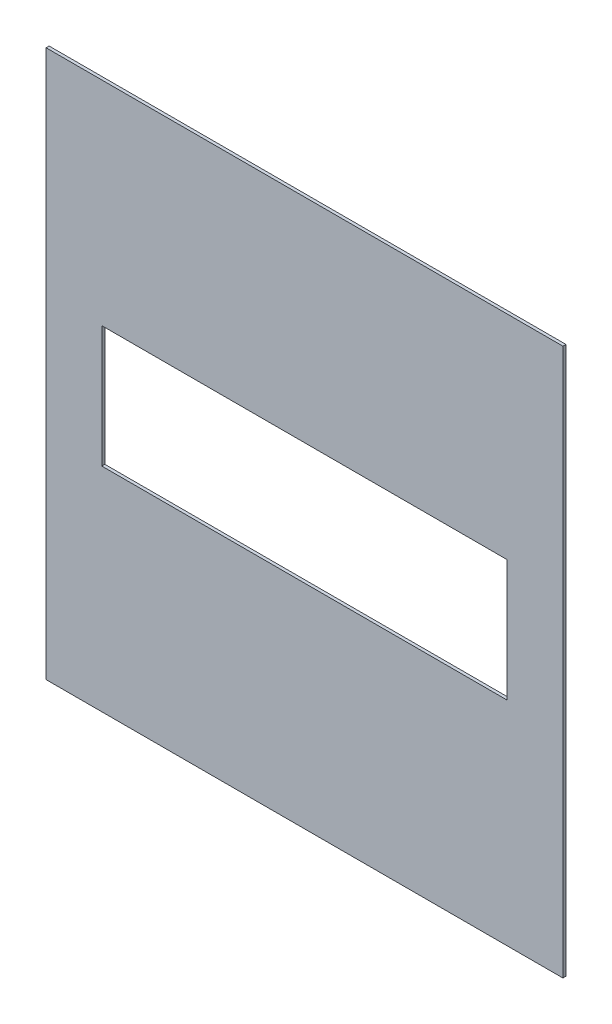
from build123d import *

# Parameters (mm, degrees)
SKETCH1_W           = 510
SKETCH1_H           = 540
BOSS_EXTRUDE1_DEPTH = 3
CUT_EXTRUDE2_REACH  = 373.395
SKETCH3_W           = 400
SKETCH3_H           = 120


with BuildPart() as part:
    # Sketch1 → Boss-Extrude1 (new body)
    with BuildSketch(Plane.XY):
        Rectangle(SKETCH1_W, SKETCH1_H)
    extrude(amount=BOSS_EXTRUDE1_DEPTH)

    # Sketch3 → Cut-Extrude2 (cut, up to next)
    with BuildSketch(Plane.XY.offset(3), mode=Mode.PRIVATE) as cut_extrude2_sk1:
        Rectangle(SKETCH3_W, SKETCH3_H)
    cut_extrude2_tool1 = extrude(cut_extrude2_sk1.sketch, amount=-CUT_EXTRUDE2_REACH, mode=Mode.PRIVATE) & part.part
    add(cut_extrude2_tool1.solids().sort_by_distance((0, 0, 3))[0], mode=Mode.SUBTRACT)


solid = part.part
